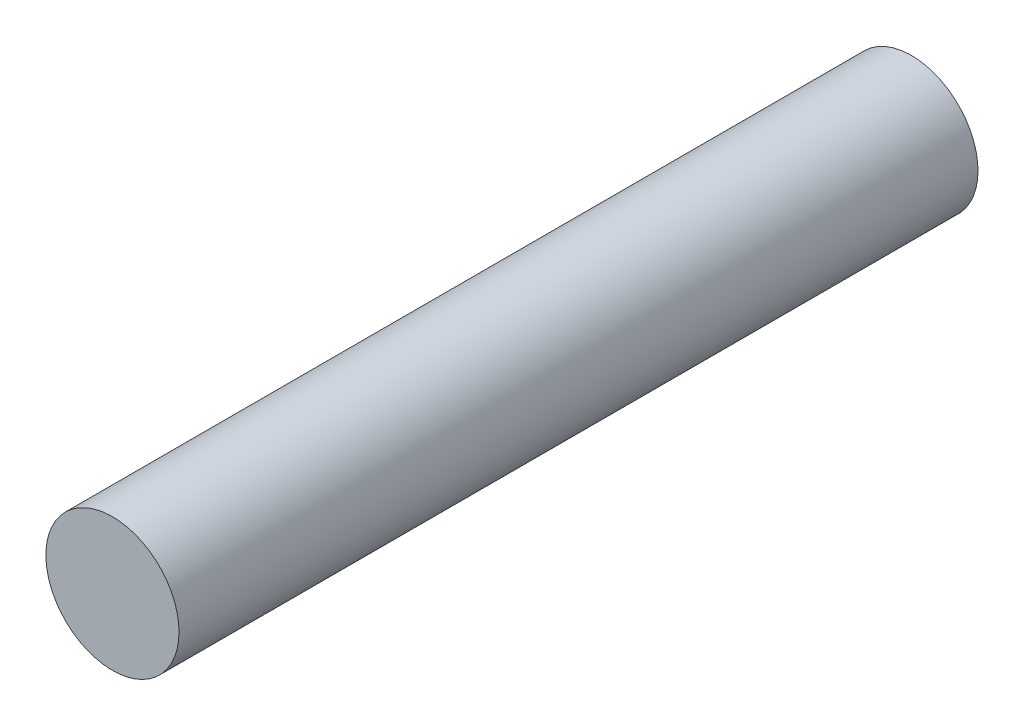
from build123d import *

# Parameters (mm, degrees)
SKETCH1_R           = 0.125
BOSS_EXTRUDE1_DEPTH = 1.5


with BuildPart() as part:
    # Sketch1 → Boss-Extrude1 (new body)
    with BuildSketch(Plane.XY):
        Circle(SKETCH1_R)
    extrude(amount=BOSS_EXTRUDE1_DEPTH)


solid = part.part
